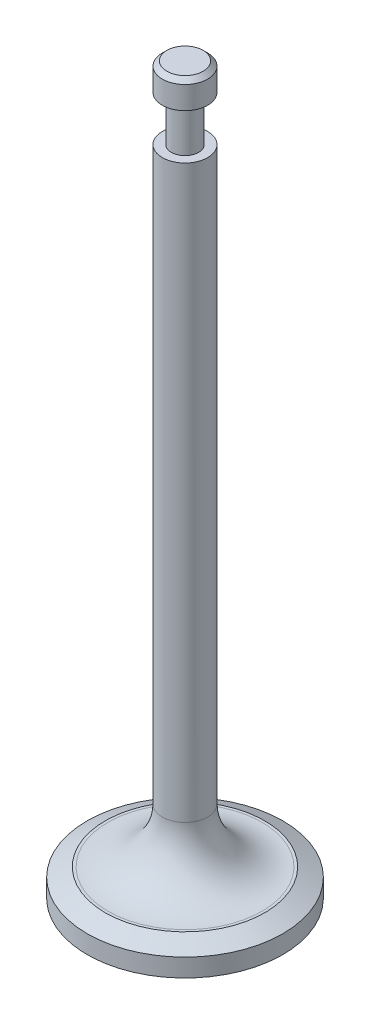
from build123d import *

# Parameters (mm, degrees)
FILLET1_R      = 6
CHAMFER1_SIZE  = 0.5
CHAMFER2_SIZE  = 2
CHAMFER2_SIZE2 = 1


with BuildPart() as part:
    # Sketch1 → Revolve1 (revolve)
    with BuildSketch(Plane.XY, mode=Mode.PRIVATE) as revolve1_sk:
        Polygon((0, 0), (0, 80), (2.5, 80), (2.5, 77), (1.5, 77), (1.5, 72), (2.5, 72), (2.5, 3), (10.793050135, 3), (10.793050135, 0), align=None)
    revolve(revolve1_sk.sketch.rotate(Axis((0, 0, 0), (0, 1, 0)), 90), axis=Axis((0, 0, 0), (0, 1, 0)))

    # Fillet1
    fillet1_edges = [part.edges().sort_by_distance(p)[0] for p in [
        (0, 3, 2.5),
    ]]
    fillet(fillet1_edges, radius=FILLET1_R)

    # Chamfer1
    chamfer1_edges = [part.edges().sort_by_distance(p)[0] for p in [
        (0, 80, 2.5),
    ]]
    chamfer(chamfer1_edges, length=CHAMFER1_SIZE)

    # Chamfer2
    chamfer2_edges = [part.edges().sort_by_distance(p)[0] for p in [
        (0, 3, 10.793050135),
    ]]
    chamfer2_side = [part.faces().sort_by_distance(p)[0] for p in [
        (0, 3, 8.805273558),
    ]]
    chamfer(chamfer2_edges, length=CHAMFER2_SIZE, length2=CHAMFER2_SIZE2, reference=chamfer2_side[0])


solid = part.part
